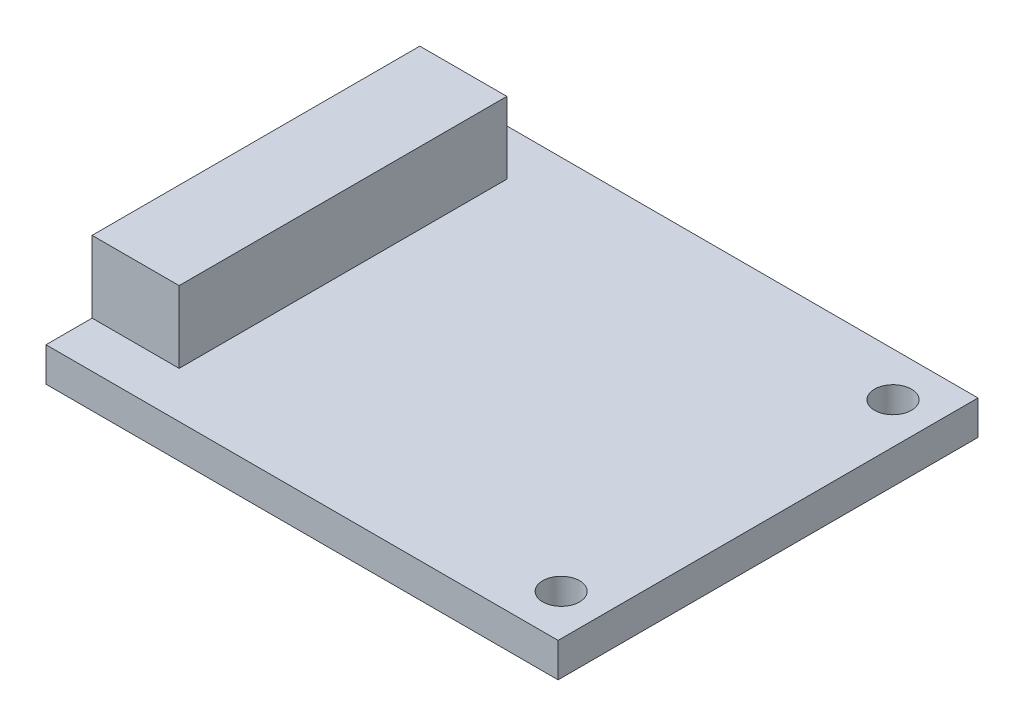
from build123d import *

# Parameters (mm, degrees)
SKETCH1_W              = 25
SKETCH1_H              = 20.5
BOSS_EXTRUDE1_DEPTH    = 1.67
M1_6_CLEARANCE_HOLE1_D = 1.8
SKETCH4_W              = 4.25
SKETCH4_H              = 16
BOSS_EXTRUDE2_DEPTH    = 3.5


with BuildPart() as part:
    # Sketch1 → Boss-Extrude1 (new body)
    with BuildSketch(Plane(origin=(0, 0, 0), x_dir=(1, 0, 0), z_dir=(0, 1, 0))):
        with Locations((12.5, 10.25)):
            Rectangle(SKETCH1_W, SKETCH1_H)
    extrude(amount=BOSS_EXTRUDE1_DEPTH)

    # M1.6 Clearance Hole1 (through all)
    with Locations(Plane(origin=(0, 1.67, 0), x_dir=(1, 0, 0), z_dir=(0, 1, 0))):
        with Locations((23, 18.35), (23, 2.15)):
            Hole(M1_6_CLEARANCE_HOLE1_D / 2)

    # Sketch4 → Boss-Extrude2 (add)
    with BuildSketch(Plane(origin=(0, 1.67, 0), x_dir=(1, 0, 0), z_dir=(0, 1, 0))):
        with Locations((2.125, 10.25)):
            Rectangle(SKETCH4_W, SKETCH4_H)
    extrude(amount=BOSS_EXTRUDE2_DEPTH)


solid = part.part
